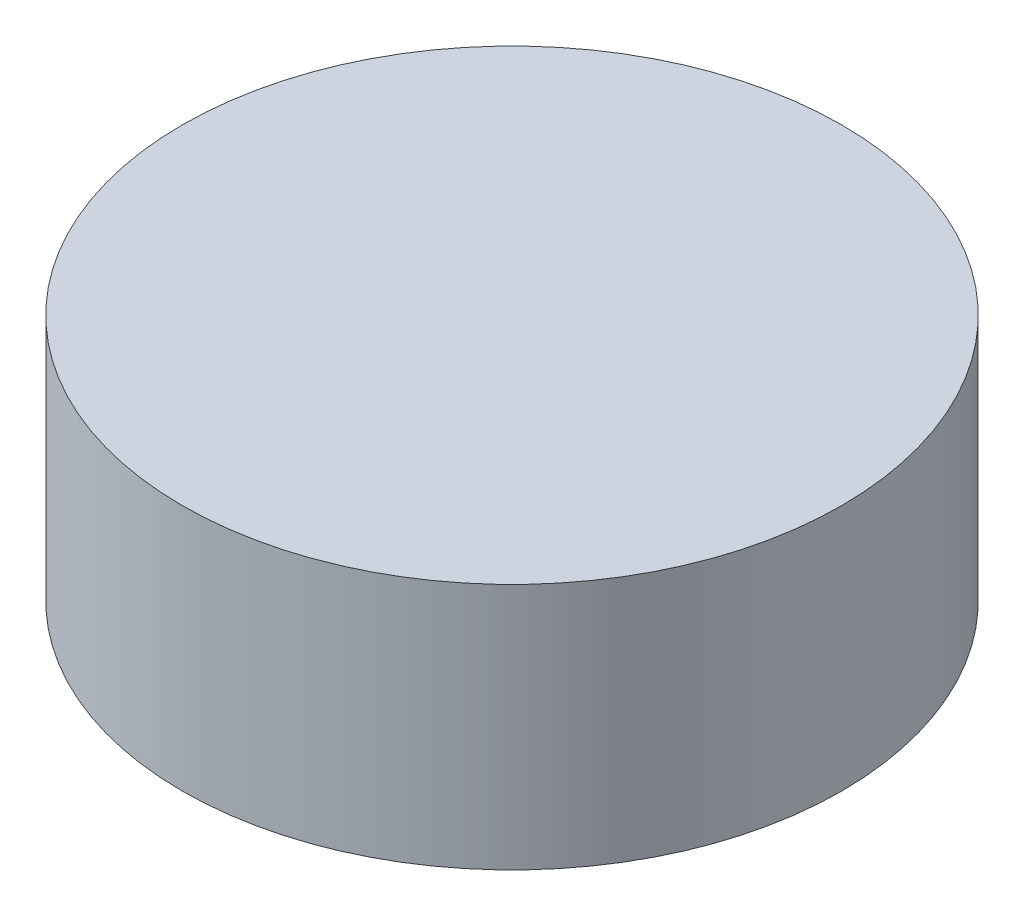
from build123d import *

# Parameters (mm, degrees)
SKETCH1_R           = 16
BOSS_EXTRUDE1_DEPTH = 10.5
SKETCH2_R           = 16
BOSS_EXTRUDE2_DEPTH = 1.5
BOSS_EXTRUDE3_START = 10.5
SKETCH3_R           = 3.5
BOSS_EXTRUDE3_DEPTH = 10.5


with BuildPart() as part:
    # Sketch1 → Boss-Extrude1 (new body)
    with BuildSketch(Plane(origin=(0, 0, 0), x_dir=(1, 0, 0), z_dir=(0, 1, 0))):
        with Locations(Location((0, 0, 0), (0, 0, 90))):
            Circle(SKETCH1_R)
        with BuildLine():
            Line((-0.754325558, 14.480365774), (-0.751021188, 3.418474393))
            ThreePointArc((-0.751021188, 3.418474393), (-0.001045508, 3.499999844), (0.748978745, 3.418922468))
            Line((0.748978745, 3.418922468), (0.745674375, 14.480813849))
            ThreePointArc((0.745674375, 14.480813849), (12.5552021, 7.25375077), (12.917527395, -6.586917791))
            Line((12.917527395, -6.586917791), (3.335996261, -1.058833769))
            ThreePointArc((3.335996261, -1.058833769), (3.031611532, -1.749094486), (2.586384338, -2.358095854))
            Line((2.586384338, -2.358095854), (12.167915473, -7.886179876))
            ThreePointArc((12.167915473, -7.886179876), (0.004331389, -14.499999353), (-12.163201838, -7.893447983))
            Line((-12.163201838, -7.893447983), (-2.584975072, -2.359640624))
            ThreePointArc((-2.584975072, -2.359640624), (-3.030566024, -1.750905358), (-3.335363083, -1.060826614))
            Line((-3.335363083, -1.060826614), (-12.913589848, -6.594633973))
            ThreePointArc((-12.913589848, -6.594633973), (-12.559533489, 7.246248583), (-0.754325558, 14.480365774))
        make_face(mode=Mode.SUBTRACT)
    extrude(amount=BOSS_EXTRUDE1_DEPTH)

    # Sketch2 → Boss-Extrude2 (add)
    with BuildSketch(Plane(origin=(0, 10.5, 0), x_dir=(1, 0, 0), z_dir=(0, 1, 0))):
        with Locations(Location((0, 0, 0), (0, 0, 90))):
            Circle(SKETCH2_R)
    extrude(amount=BOSS_EXTRUDE2_DEPTH)

    # Sketch3 → Boss-Extrude3 (add)
    with BuildSketch(Plane.XZ.offset(-10.5).offset(BOSS_EXTRUDE3_START)):
        Circle(SKETCH3_R)
        with BuildLine():
            Line((-2.598076211, -1.5), (2.598076211, -1.5))
            ThreePointArc((2.598076211, -1.5), (0, 3), (-2.598076211, -1.5))
        make_face(mode=Mode.SUBTRACT)
    extrude(amount=-BOSS_EXTRUDE3_DEPTH)


solid = part.part
